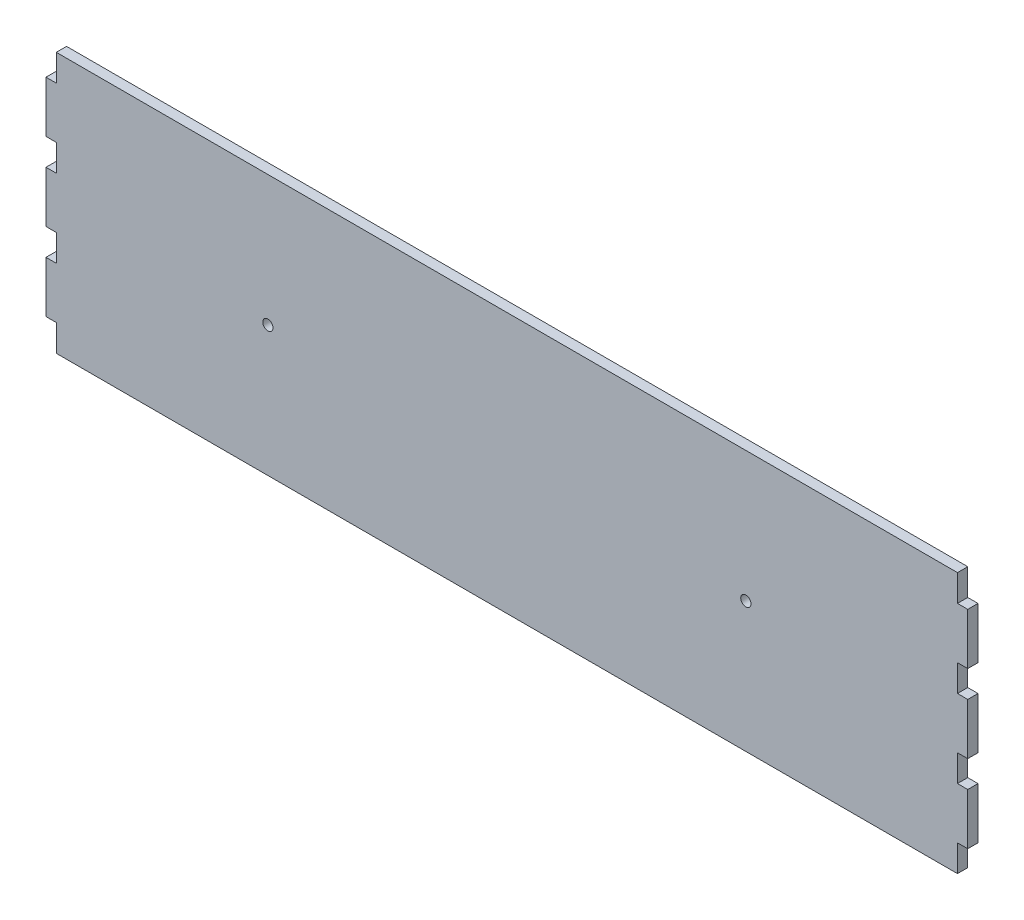
from build123d import *

# Parameters (mm, degrees)
SKETCH1_W                       = 269.4
SKETCH1_H                       = 76.2
BOSS_EXTRUDE1_DEPTH             = 3
SKETCH2_W                       = 3
SKETCH2_H                       = 7.8
CUT_EXTRUDE1_DEPTH              = 141.016784708
LPATTERN1_COUNT                 = 4
LPATTERN1_PITCH                 = 22.8
MIRROR1_COPY_1_SKETCH_W         = 3
MIRROR1_COPY_1_SKETCH_H         = 7.8
MIRROR1_COPY_1_DEPTH            = 141.016784708
MIRROR1_COPY_2_SKETCH_W         = 3
MIRROR1_COPY_2_SKETCH_H         = 7.8
MIRROR1_COPY_2_DEPTH            = 141.016784708
MIRROR1_COPY_3_SKETCH_W         = 3
MIRROR1_COPY_3_SKETCH_H         = 7.8
MIRROR1_COPY_3_DEPTH            = 141.016784708
F_3_0MM_CLEARANCE_DOWEL_HOLE1_D = 3


with BuildPart() as part:
    # Sketch1 → Boss-Extrude1 (new body)
    with BuildSketch(Plane.XY):
        Rectangle(SKETCH1_W, SKETCH1_H)
    extrude(amount=BOSS_EXTRUDE1_DEPTH)

    # Sketch2 → Cut-Extrude1 (cut, through all)
    with BuildSketch(Plane.XY.offset(3)):
        with Locations((-133.2, 34.2)):
            Rectangle(SKETCH2_W, SKETCH2_H)
    cut_extrude1 = extrude(amount=-CUT_EXTRUDE1_DEPTH, mode=Mode.SUBTRACT)

    # LPattern1: Cut-Extrude1 ×4
    with Locations(*[(0, -i * LPATTERN1_PITCH, 0) for i in range(1, LPATTERN1_COUNT)]):
        add(cut_extrude1, mode=Mode.SUBTRACT)

    # Mirror1: Cut-Extrude1 across plane
    add(cut_extrude1.mirror(Plane(origin=(0, 0, 0), x_dir=(0, 0, 1), z_dir=(1, 0, 0))), mode=Mode.SUBTRACT)

    # Mirror1 copy 1 sketch → Mirror1 copy 1 (cut, through all)
    with BuildSketch(Plane(origin=(0, -22.8, 3), x_dir=(-1, 0, 0), z_dir=(0, 0, 1))):
        with Locations((-133.2, -34.2)):
            Rectangle(MIRROR1_COPY_1_SKETCH_W, MIRROR1_COPY_1_SKETCH_H)
    extrude(amount=-MIRROR1_COPY_1_DEPTH, mode=Mode.SUBTRACT)

    # Mirror1 copy 2 sketch → Mirror1 copy 2 (cut, through all)
    with BuildSketch(Plane(origin=(0, -45.6, 3), x_dir=(-1, 0, 0), z_dir=(0, 0, 1))):
        with Locations((-133.2, -34.2)):
            Rectangle(MIRROR1_COPY_2_SKETCH_W, MIRROR1_COPY_2_SKETCH_H)
    extrude(amount=-MIRROR1_COPY_2_DEPTH, mode=Mode.SUBTRACT)

    # Mirror1 copy 3 sketch → Mirror1 copy 3 (cut, through all)
    with BuildSketch(Plane(origin=(0, -68.4, 3), x_dir=(-1, 0, 0), z_dir=(0, 0, 1))):
        with Locations((-133.2, -34.2)):
            Rectangle(MIRROR1_COPY_3_SKETCH_W, MIRROR1_COPY_3_SKETCH_H)
    extrude(amount=-MIRROR1_COPY_3_DEPTH, mode=Mode.SUBTRACT)

    # Ø3.0mm Clearance Dowel Hole1 (through all)
    with Locations(Plane.XY.offset(3)):
        with Locations((-69.85, 0), (69.85, 0)):
            Hole(F_3_0MM_CLEARANCE_DOWEL_HOLE1_D / 2)


solid = part.part
